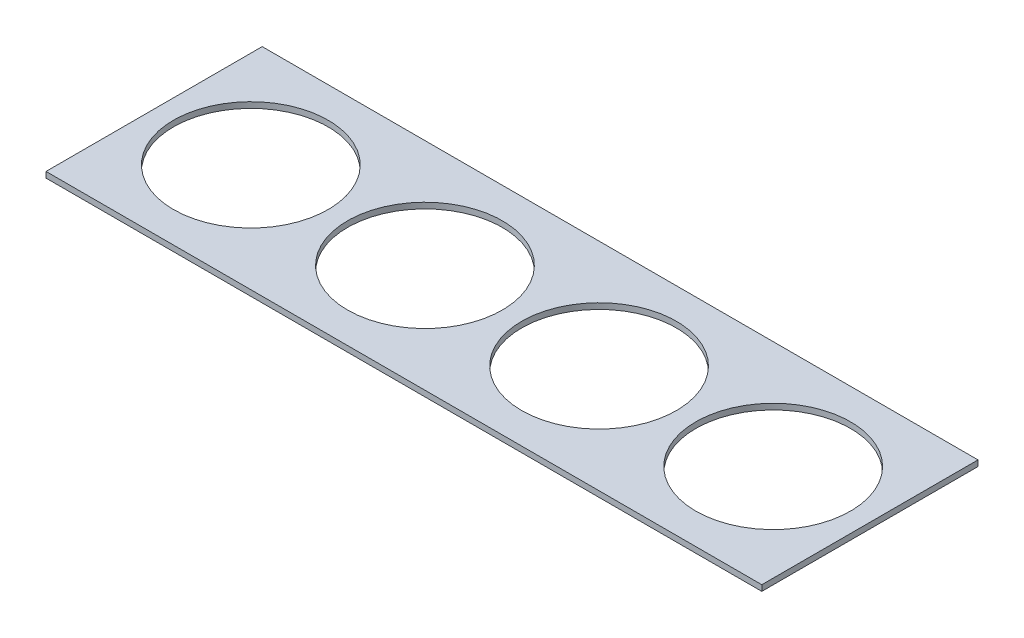
from build123d import *

# Parameters (mm, degrees)
SKETCH1_W           = 370
SKETCH1_H           = 111.75
SKETCH1_R           = 40
BOSS_EXTRUDE1_DEPTH = 3


with BuildPart() as part:
    # Sketch1 → Boss-Extrude1 (new body)
    with BuildSketch(Plane(origin=(0, 0, 0), x_dir=(1, 0, 0), z_dir=(0, 1, 0))):
        with Locations((-103.537869001, 9.06015636)):
            Rectangle(SKETCH1_W, SKETCH1_H)
        with Locations(Location((-238.537869001, 9.06015636, 0), (0, 0, 270))):
            Circle(SKETCH1_R, mode=Mode.SUBTRACT)
        with Locations(Location((-148.537869001, 9.06015636, 0), (0, 0, 270))):
            Circle(SKETCH1_R, mode=Mode.SUBTRACT)
        with Locations(Location((-58.537869001, 9.06015636, 0), (0, 0, 270))):
            Circle(SKETCH1_R, mode=Mode.SUBTRACT)
        with Locations(Location((31.462130999, 9.06015636, 0), (0, 0, 270))):
            Circle(SKETCH1_R, mode=Mode.SUBTRACT)
    extrude(amount=BOSS_EXTRUDE1_DEPTH)


solid = part.part
